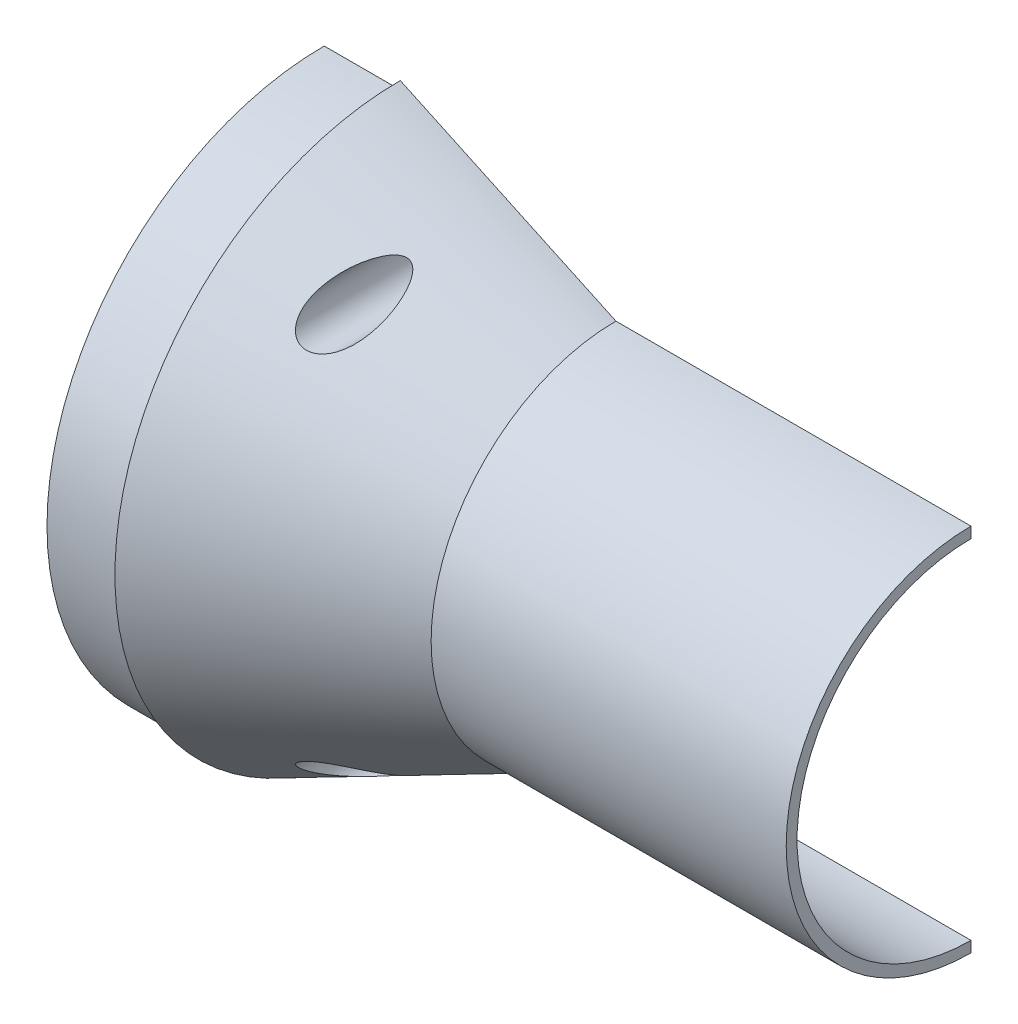
from build123d import *

# Parameters (mm, degrees)
REVOLVE_2_ANGLE     = 180
EXTRUDE_3_REACH     = 142.262
SKETCH_1_12_R       = 4.474143501
CUT_EXTRUDE_3_DEPTH = 204.9
SKETCH_1_14_R       = 4.474143501
EXTRUDE_4_DEPTH     = 10
SKETCH_1_16_R       = 3
CUT_EXTRUDE_4_DEPTH = 32


with BuildPart() as part:
    # Эскиз1 → Повернуть2 (revolve)
    with BuildSketch(Plane.XY):
        Polygon((0, 51), (0, 35), (7, 35), (7, 32), (10, 32), (10, 48.5), (14, 48.5), (25, 43.925143786), (31.718111621, 41.131107905), (35, 39.766183592), (53.673378029, 32), (119, 32), (119, 34), (53.673378029, 34), (14, 52.5), (14, 51), align=None)
    revolve(axis=Axis((0, 0, 0), (1, 0, 0)), revolution_arc=REVOLVE_2_ANGLE)

    # Эскиз1<11> → Бобышка-Вытянуть3 (add, up to next)
    with BuildSketch(Plane.XY, mode=Mode.PRIVATE) as extrude_3_sk1:
        Polygon((25, 43.925143786), (25, 32), (35, 32), (35, 39.766183592), align=None)
    extrude_3_tool1 = extrude(extrude_3_sk1.sketch, amount=EXTRUDE_3_REACH, mode=Mode.PRIVATE) - part.part
    extrude_3 = extrude_3_tool1.solids().sort_by_distance((29.647987, 36.996032, 0))[0]
    add(extrude_3)

    # Эскиз1<12> → Вырез-Вытянуть3 (cut)
    with BuildSketch(Plane.XY):
        with Locations((30, 37)):
            Circle(SKETCH_1_12_R)
    cut_extrude_3 = extrude(amount=CUT_EXTRUDE_3_DEPTH, mode=Mode.SUBTRACT)

    # Эскиз1<14> → Бобышка-Вытянуть4 (add)
    with BuildSketch(Plane.XY):
        with Locations((30, 37)):
            Circle(SKETCH_1_14_R)
    extrude_4 = extrude(amount=EXTRUDE_4_DEPTH)

    # Эскиз1<16> → Вырез-Вытянуть4 (cut)
    with BuildSketch(Plane.XY):
        with Locations((30, 37)):
            Circle(SKETCH_1_16_R)
    cut_extrude_4 = extrude(amount=CUT_EXTRUDE_4_DEPTH, mode=Mode.SUBTRACT)

    # Зеркальное отражение1: Бобышка-Вытянуть3, Вырез-Вытянуть3, Бобышка-Вытянуть4, Вырез-Вытянуть4 across plane
    add(extrude_3.mirror(Plane.ZX))
    add(cut_extrude_3.mirror(Plane.ZX), mode=Mode.SUBTRACT)
    add(extrude_4.mirror(Plane.ZX))
    add(cut_extrude_4.mirror(Plane.ZX), mode=Mode.SUBTRACT)


solid = part.part
